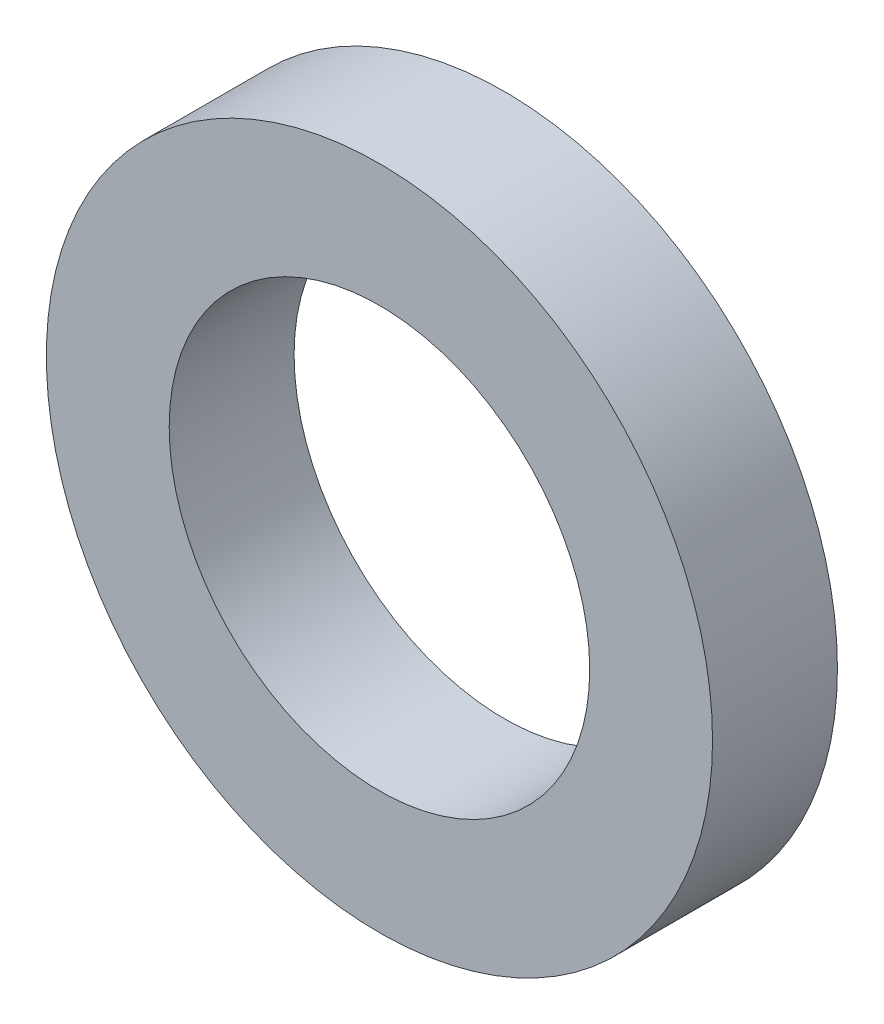
from build123d import *

# Parameters (mm, degrees)
SKETCH1_R           = 16
SKETCH1_R_2         = 10.1
BOSS_EXTRUDE1_DEPTH = 3


with BuildPart() as part:
    # Sketch1 → Boss-Extrude1 (new, symmetric)
    with BuildSketch(Plane.XY):
        Circle(SKETCH1_R)
        Circle(SKETCH1_R_2, mode=Mode.SUBTRACT)
    extrude(amount=BOSS_EXTRUDE1_DEPTH, both=True)


solid = part.part
